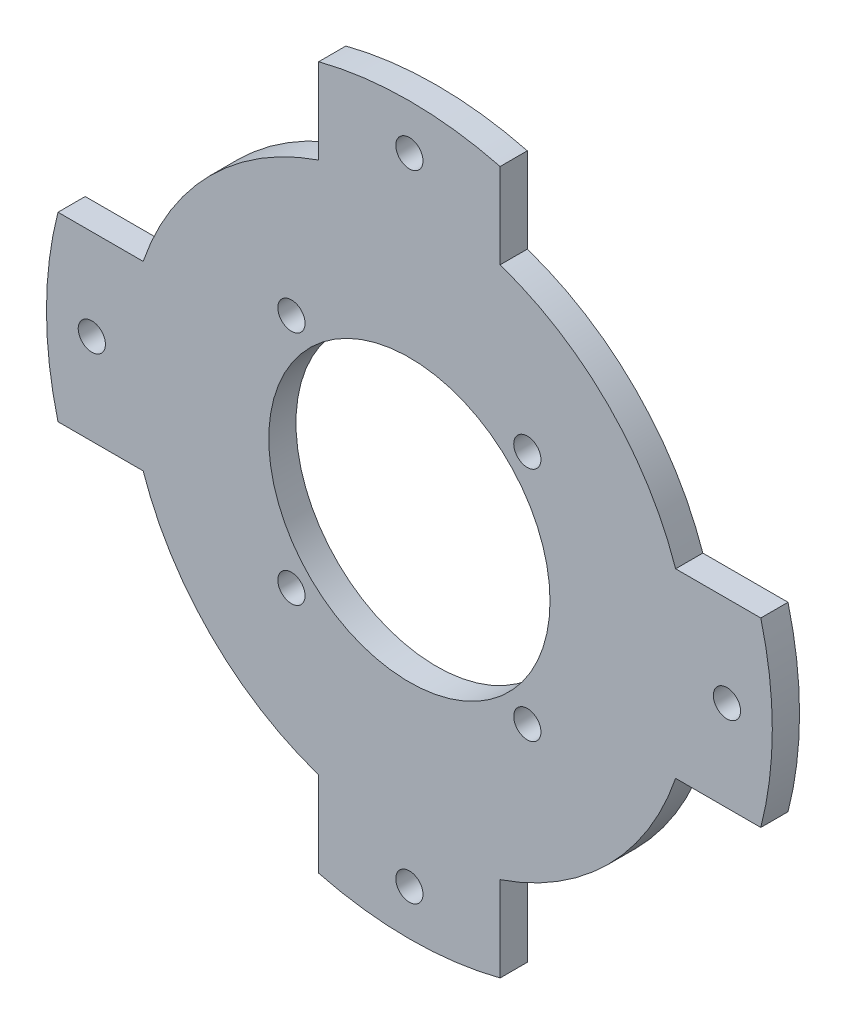
from build123d import *

# Parameters (mm, degrees)
BOSS_EXTRUDE2_DEPTH = 3
CUT_EXTRUDE1_REACH  = 58.648
SKETCH3_R           = 1.5
SKETCH4_R           = 15.5
SKETCH4_R_2         = 1.5
CUT_EXTRUDE2_DEPTH  = 3


with BuildPart() as part:
    # Sketch2 → Boss-Extrude2 (new body)
    with BuildSketch(Plane.XY):
        with BuildLine():
            Line((-10, -29.342801502), (-10, -38.729833462))
            ThreePointArc((-10, -38.729833462), (0, -40), (10, -38.729833462))
            Line((10, -38.729833462), (10, -29.342801502))
            ThreePointArc((10, -29.342801502), (21.920310217, -21.920310217), (29.342801502, -10))
            Line((29.342801502, -10), (38.729833462, -10))
            ThreePointArc((38.729833462, -10), (40, 0), (38.729833462, 10))
            Line((38.729833462, 10), (29.342801502, 10))
            ThreePointArc((29.342801502, 10), (21.920310217, 21.920310217), (10, 29.342801502))
            Line((10, 29.342801502), (10, 38.729833462))
            ThreePointArc((10, 38.729833462), (0, 40), (-10, 38.729833462))
            Line((-10, 38.729833462), (-10, 29.342801502))
            ThreePointArc((-10, 29.342801502), (-21.920310217, 21.920310217), (-29.342801502, 10))
            Line((-29.342801502, 10), (-38.729833462, 10))
            ThreePointArc((-38.729833462, 10), (-40, 0), (-38.729833462, -10))
            Line((-38.729833462, -10), (-29.342801502, -10))
            ThreePointArc((-29.342801502, -10), (-21.920310217, -21.920310217), (-10, -29.342801502))
        make_face()
    extrude(amount=BOSS_EXTRUDE2_DEPTH)

    # Sketch3 → Cut-Extrude1 (cut, up to next)
    with BuildSketch(Plane.XY.offset(3), mode=Mode.PRIVATE) as cut_extrude1_sk1:
        with Locations((0, 35)):
            Circle(SKETCH3_R)
    cut_extrude1_tool1 = extrude(cut_extrude1_sk1.sketch, amount=-CUT_EXTRUDE1_REACH, mode=Mode.PRIVATE) & part.part
    # Sketch3 → Cut-Extrude1 (cut, up to next)
    with BuildSketch(Plane.XY.offset(3), mode=Mode.PRIVATE) as cut_extrude1_sk2:
        with Locations((35, 0)):
            Circle(SKETCH3_R)
    cut_extrude1_tool2 = extrude(cut_extrude1_sk2.sketch, amount=-CUT_EXTRUDE1_REACH, mode=Mode.PRIVATE) & part.part
    # Sketch3 → Cut-Extrude1 (cut, up to next)
    with BuildSketch(Plane.XY.offset(3), mode=Mode.PRIVATE) as cut_extrude1_sk3:
        with Locations((0, -35)):
            Circle(SKETCH3_R)
    cut_extrude1_tool3 = extrude(cut_extrude1_sk3.sketch, amount=-CUT_EXTRUDE1_REACH, mode=Mode.PRIVATE) & part.part
    # Sketch3 → Cut-Extrude1 (cut, up to next)
    with BuildSketch(Plane.XY.offset(3), mode=Mode.PRIVATE) as cut_extrude1_sk4:
        with Locations((-35, 0)):
            Circle(SKETCH3_R)
    cut_extrude1_tool4 = extrude(cut_extrude1_sk4.sketch, amount=-CUT_EXTRUDE1_REACH, mode=Mode.PRIVATE) & part.part
    add(cut_extrude1_tool1.solids().sort_by_distance((0, 35, 3))[0], mode=Mode.SUBTRACT)
    add(cut_extrude1_tool2.solids().sort_by_distance((35, 0, 3))[0], mode=Mode.SUBTRACT)
    add(cut_extrude1_tool3.solids().sort_by_distance((0, -35, 3))[0], mode=Mode.SUBTRACT)
    add(cut_extrude1_tool4.solids().sort_by_distance((-35, 0, 3))[0], mode=Mode.SUBTRACT)

    # Sketch4 → Cut-Extrude2 (cut)
    with BuildSketch(Plane.XY.offset(3)):
        Circle(SKETCH4_R)
        with Locations((-13, 13)):
            Circle(SKETCH4_R_2)
        with Locations(Location((-13, -13, 0), (0, 0, 180))):
            Circle(SKETCH4_R_2)
        with Locations((13, -13)):
            Circle(SKETCH4_R_2)
        with Locations(Location((13, 13, 0), (0, 0, 180))):
            Circle(SKETCH4_R_2)
    extrude(amount=-CUT_EXTRUDE2_DEPTH, mode=Mode.SUBTRACT)


solid = part.part
